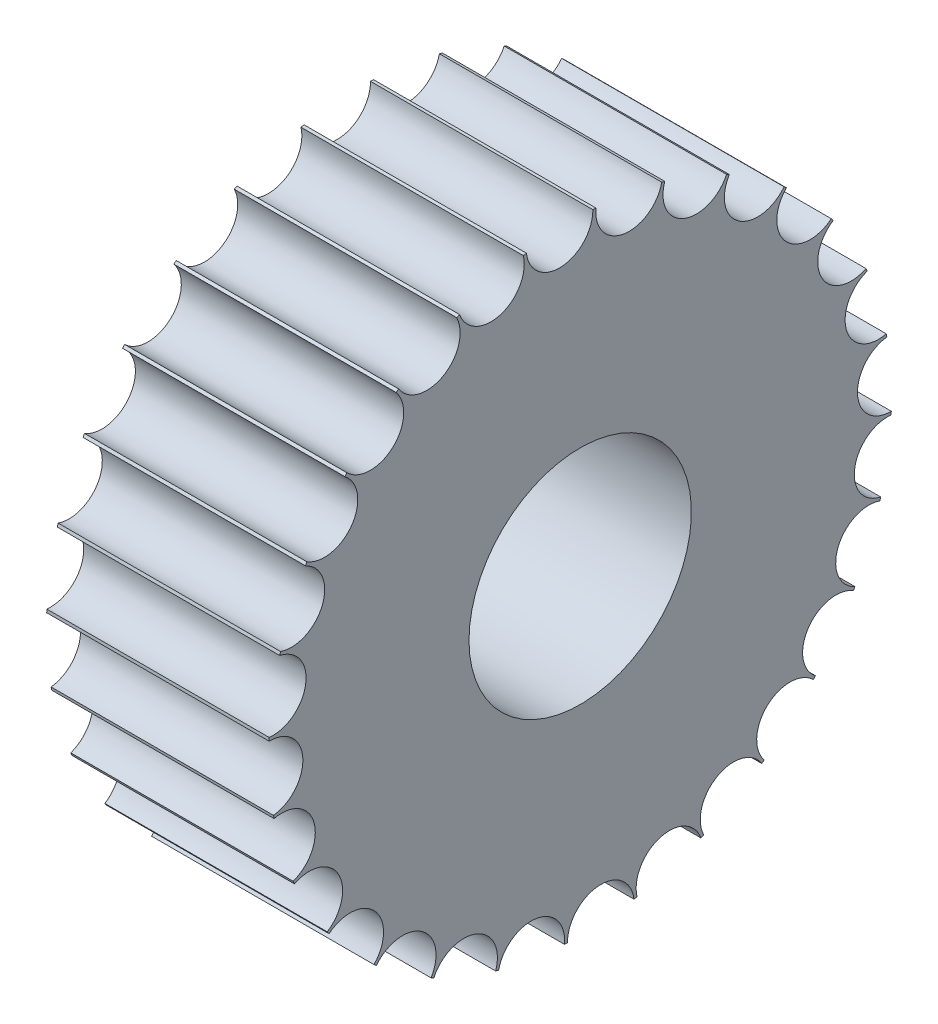
from build123d import *

# Parameters (mm, degrees)
CUT_EXTRUDE_1_DEPTH      = 10
PATTERN_CIRCULAR_2_COUNT = 28
SKETCH_3_R               = 5
CUT_EXTRUDE_2_DEPTH      = 26.454679665


with BuildPart() as part:
    # 草图1 → 旋转1 (revolve)
    with BuildSketch(Plane.XY, mode=Mode.PRIVATE) as revolve_1_sk:
        Polygon((-4.537524852, 10.783302268), (-14.537524852, 10.783302268), (-14.537524852, 1.783302268), (-15.787524852, 1.783302268), (-15.787524852, -3.216697732), (-3.287524852, -3.216697732), (-3.287524852, 1.783302268), (-4.537524852, 1.783302268), align=None)
    revolve(revolve_1_sk.sketch.rotate(Axis((-37.951477077, -3.216697732, 0), (1, 0, 0)), 90), axis=Axis((-37.951477077, -3.216697732, 0), (1, 0, 0)))

    # 草图2 → 切除-拉伸1 (cut)
    with BuildSketch(Plane.ZY.offset(14.537524852)):
        with BuildLine():
            Line((0.390901935, 85.320682721), (-0.569796452, 10.771702176))
            ThreePointArc((-0.569796452, 10.771702176), (0.830427689, 9.255687358), (2.419277547, 10.572685726))
            Line((2.419277547, 10.572685726), (11.35038276, 84.590986174))
            Line((11.35038276, 84.590986174), (21.256411219, 233.371913604))
            Line((21.256411219, 233.371913604), (10.296930394, 234.10161015))
            Line((10.296930394, 234.10161015), (0.390901935, 85.320682721))
        make_face()
    cut_extrude_1 = extrude(amount=-CUT_EXTRUDE_1_DEPTH, mode=Mode.SUBTRACT)

    # 阵列(圆周)2: 切除-拉伸1 ×28 about axis
    pattern_circular_2_axis = Axis((0, -3.216697732, 0), (1, 0, 0))
    for i in range(1, PATTERN_CIRCULAR_2_COUNT):
        add(cut_extrude_1.rotate(pattern_circular_2_axis, i * 360 / PATTERN_CIRCULAR_2_COUNT), mode=Mode.SUBTRACT)

    # 草图3 → 切除-拉伸2 (cut, through all)
    with BuildSketch(Plane.ZY.offset(15.787524852)):
        with Locations((0, -3.216697732)):
            Circle(SKETCH_3_R)
    extrude(amount=-CUT_EXTRUDE_2_DEPTH, mode=Mode.SUBTRACT)


solid = part.part
